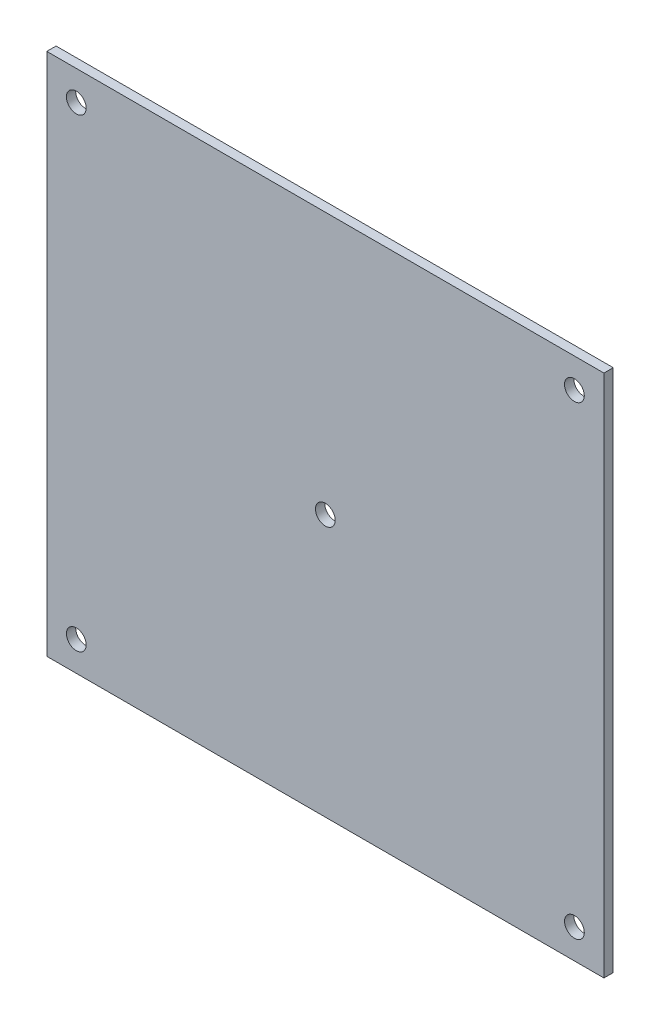
from build123d import *

# Parameters (mm, degrees)
BODY_SKETCH_W    = 95.89
BODY_SKETCH_H    = 90.17
BODY_DEPTH       = 1.6
HOLES_DEPTH      = 132.636169042
HOLES_DEPTH_BACK = 132.636169042
HOLES_SKETCH_R   = 1.7


with BuildPart() as part:
    # Body sketch → Body (new body)
    with BuildSketch(Plane.XY):
        with Locations((47.945, 45.085)):
            Rectangle(BODY_SKETCH_W, BODY_SKETCH_H)
    extrude(amount=BODY_DEPTH)

    # Holes sketch → Holes (cut, two sides: drawn at the far end of the back side and taken through both)
    with BuildSketch(Plane.XY.offset(-HOLES_DEPTH_BACK)):
        with Locations((5.08, 5.08)):
            Circle(HOLES_SKETCH_R)
        with Locations((90.81, 5.08)):
            Circle(HOLES_SKETCH_R)
        with Locations((5.08, 85.09)):
            Circle(HOLES_SKETCH_R)
        with Locations((90.81, 85.09)):
            Circle(HOLES_SKETCH_R)
        with Locations((47.945, 45.085)):
            Circle(HOLES_SKETCH_R)
    extrude(amount=HOLES_DEPTH + HOLES_DEPTH_BACK, mode=Mode.SUBTRACT)


solid = part.part
